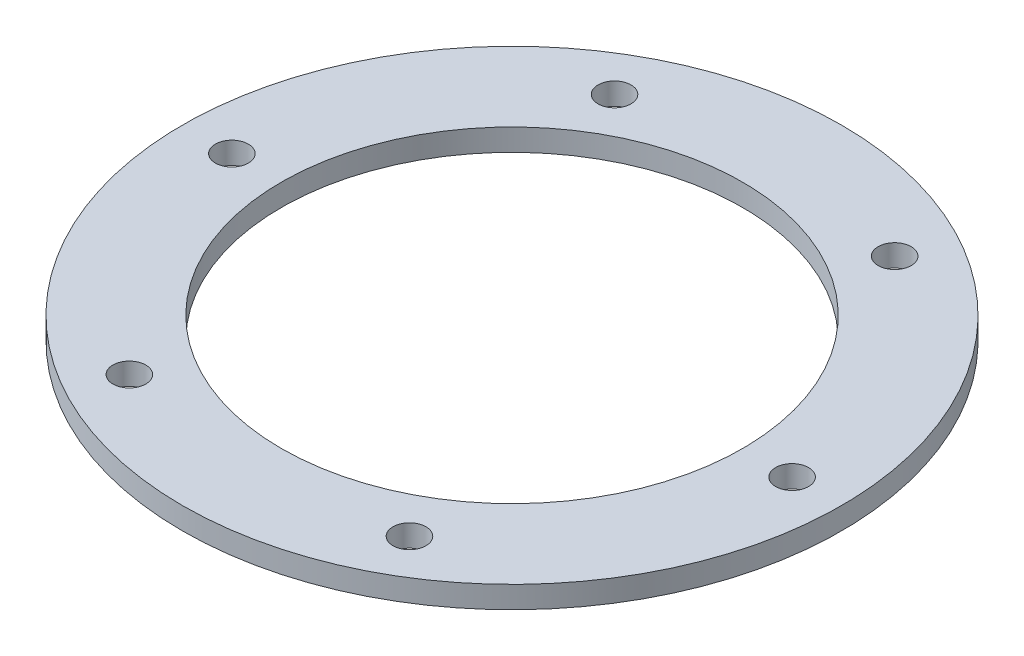
from build123d import *

# Parameters (mm, degrees)
SKETCH1_R           = 30
SKETCH1_R_2         = 21
SKETCH1_R_3         = 1.5
BOSS_EXTRUDE1_DEPTH = 2


with BuildPart() as part:
    # Sketch1 → Boss-Extrude1 (new body)
    with BuildSketch(Plane(origin=(0, 0, 0), x_dir=(1, 0, 0), z_dir=(0, 1, 0))):
        with Locations(Location((0, 0, 0), (0, 0, 270))):
            Circle(SKETCH1_R)
        with Locations(Location((0, 0, 0), (0, 0, 270))):
            Circle(SKETCH1_R_2, mode=Mode.SUBTRACT)
        with Locations(Location((-12.75, 22.083647797, 0), (0, 0, 270))):
            Circle(SKETCH1_R_3, mode=Mode.SUBTRACT)
        with Locations(Location((12.75, 22.083647797, 0), (0, 0, 270))):
            Circle(SKETCH1_R_3, mode=Mode.SUBTRACT)
        with Locations(Location((25.5, 0, 0), (0, 0, 270))):
            Circle(SKETCH1_R_3, mode=Mode.SUBTRACT)
        with Locations(Location((12.75, -22.083647797, 0), (0, 0, 270))):
            Circle(SKETCH1_R_3, mode=Mode.SUBTRACT)
        with Locations(Location((-12.75, -22.083647797, 0), (0, 0, 270))):
            Circle(SKETCH1_R_3, mode=Mode.SUBTRACT)
        with Locations(Location((-25.5, 0, 0), (0, 0, 270))):
            Circle(SKETCH1_R_3, mode=Mode.SUBTRACT)
    extrude(amount=BOSS_EXTRUDE1_DEPTH)


solid = part.part
